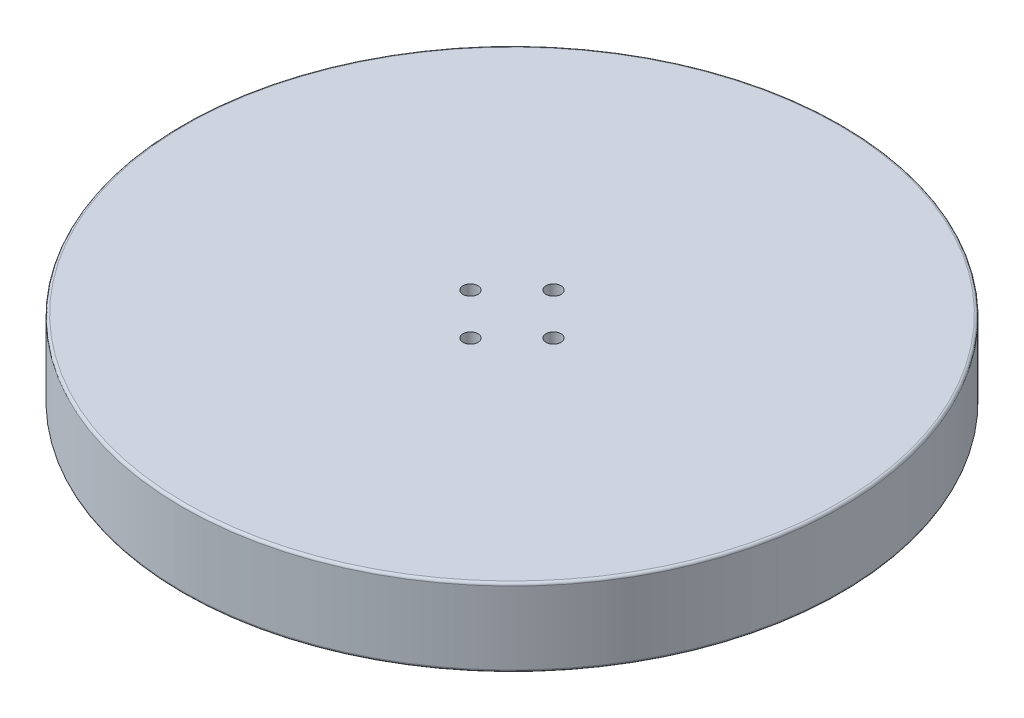
from build123d import *

# Parameters (mm, degrees)
SKETCH2_R           = 63.5
BOSS_EXTRUDE1_DEPTH = 15
SKETCH3_R           = 1.45
CUT_EXTRUDE1_DEPTH  = 92.046691318
FILLET2_R           = 0.5


with BuildPart() as part:
    # Sketch2 → Boss-Extrude1 (new body)
    with BuildSketch(Plane(origin=(0, 0, 0), x_dir=(1, 0, 0), z_dir=(0, 1, 0))):
        with Locations(Location((0, 0, 0), (0, 0, 270))):
            Circle(SKETCH2_R)
    extrude(amount=BOSS_EXTRUDE1_DEPTH)

    # Sketch3 → Cut-Extrude1 (cut, through all)
    with BuildSketch(Plane(origin=(0, 15, 0), x_dir=(1, 0, 0), z_dir=(0, 1, 0))):
        with Locations(Location((0, 8, 0), (0, 0, 270))):
            Circle(SKETCH3_R)
        with Locations(Location((8, 0, 0), (0, 0, 270))):
            Circle(SKETCH3_R)
        with Locations(Location((0, -8, 0), (0, 0, 270))):
            Circle(SKETCH3_R)
        with Locations(Location((-8, 0, 0), (0, 0, 270))):
            Circle(SKETCH3_R)
    extrude(amount=-CUT_EXTRUDE1_DEPTH, mode=Mode.SUBTRACT)

    # Fillet2
    fillet2_edges = [part.edges().sort_by_distance(p)[0] for p in [
        (0, 0, -63.5),
        (0, 15, -63.5),
    ]]
    fillet(fillet2_edges, radius=FILLET2_R)


solid = part.part
